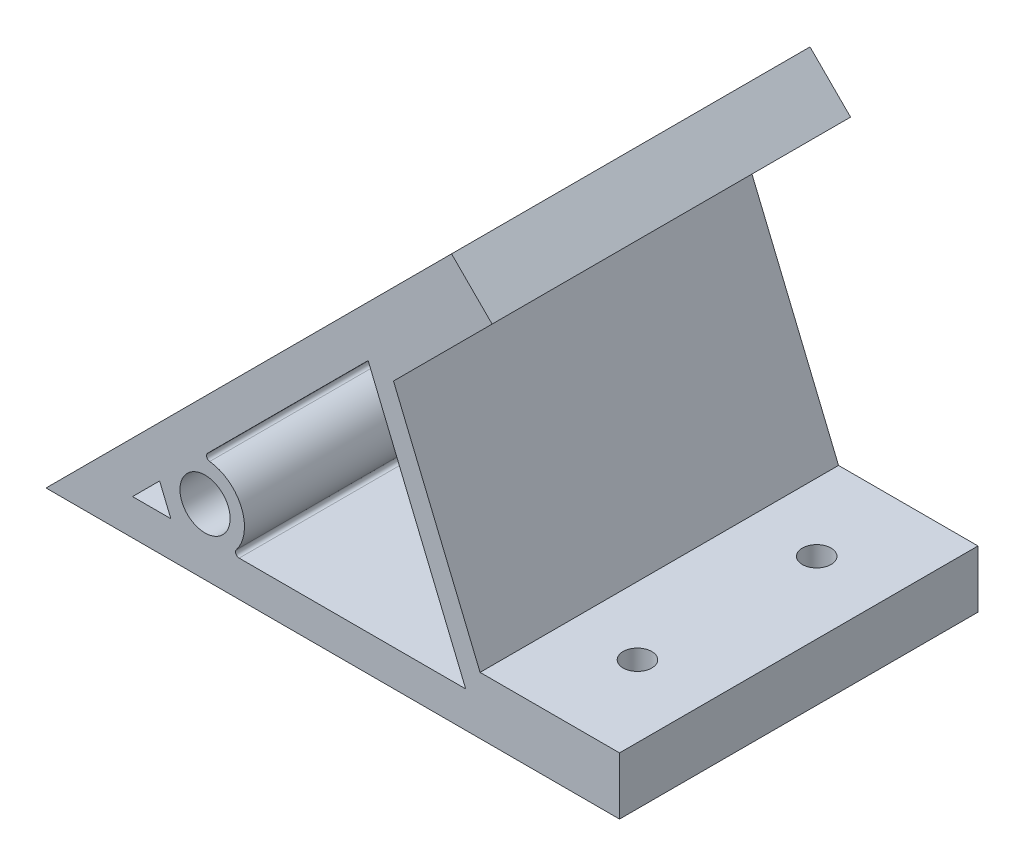
from build123d import *

# Parameters (mm, degrees)
SKETCH_1_R          = 3.5
EXTRUDE_1_DEPTH     = 25
SKETCH_2_R          = 2
CUT_EXTRUDE_1_DEPTH = 20
SKETCH_3_R          = 2
CUT_EXTRUDE_2_DEPTH = 20


with BuildPart() as part:
    # 草图1 → 凸台-拉伸1 (new, symmetric)
    with BuildSketch(Plane.XY):
        Polygon((0, 0), (56.568542495, 56.568542495), (62.225396744, 50.911688245), (48.470353518, 37.156645019), (60.547431318, 8), (80, 8), (80, 0), align=None)
        with Locations((22.184677187, 9.156473773)):
            Circle(SKETCH_1_R, mode=Mode.SUBTRACT)
        Polygon((12.071067812, 5), (15.847671377, 8.776603565), (17.411991793, 5), align=None, mode=Mode.SUBTRACT)
        with BuildLine():
            Line((22.539170943, 15.468103131), (44.931612237, 37.860544425))
            Line((44.931612237, 37.860544425), (58.542895405, 5))
            Line((58.542895405, 5), (26.941798117, 5))
            ThreePointArc((26.941798117, 5), (26.493271042, 5.27903968), (26.545371373, 5.804706148))
            ThreePointArc((26.545371373, 5.804706148), (27.253512915, 11.291164467), (22.833720405, 14.61804341))
            ThreePointArc((22.833720405, 14.61804341), (22.420282519, 14.950846558), (22.539170943, 15.468103131))
        make_face(mode=Mode.SUBTRACT)
    extrude(amount=EXTRUDE_1_DEPTH, both=True)

    # 草图2 → 切除-拉伸1 (cut)
    with BuildSketch(Plane(origin=(0, 0, 0), x_dir=(0, 0, 1), z_dir=(-0.7071067811865488, 0.7071067811865464, 0))):
        with Locations(Location((-12.5, 70, 0), (0, 0, 270))):
            Circle(SKETCH_2_R)
        with Locations(Location((12.5, 70, 0), (0, 0, 270))):
            Circle(SKETCH_2_R)
    extrude(amount=-CUT_EXTRUDE_1_DEPTH, mode=Mode.SUBTRACT)

    # 草图3 → 切除-拉伸2 (cut)
    with BuildSketch(Plane.XZ):
        with Locations(Location((70, 12.5, 0), (0, 0, 270))):
            Circle(SKETCH_3_R)
        with Locations(Location((70, -12.5, 0), (0, 0, 270))):
            Circle(SKETCH_3_R)
    extrude(amount=-CUT_EXTRUDE_2_DEPTH, mode=Mode.SUBTRACT)


solid = part.part
